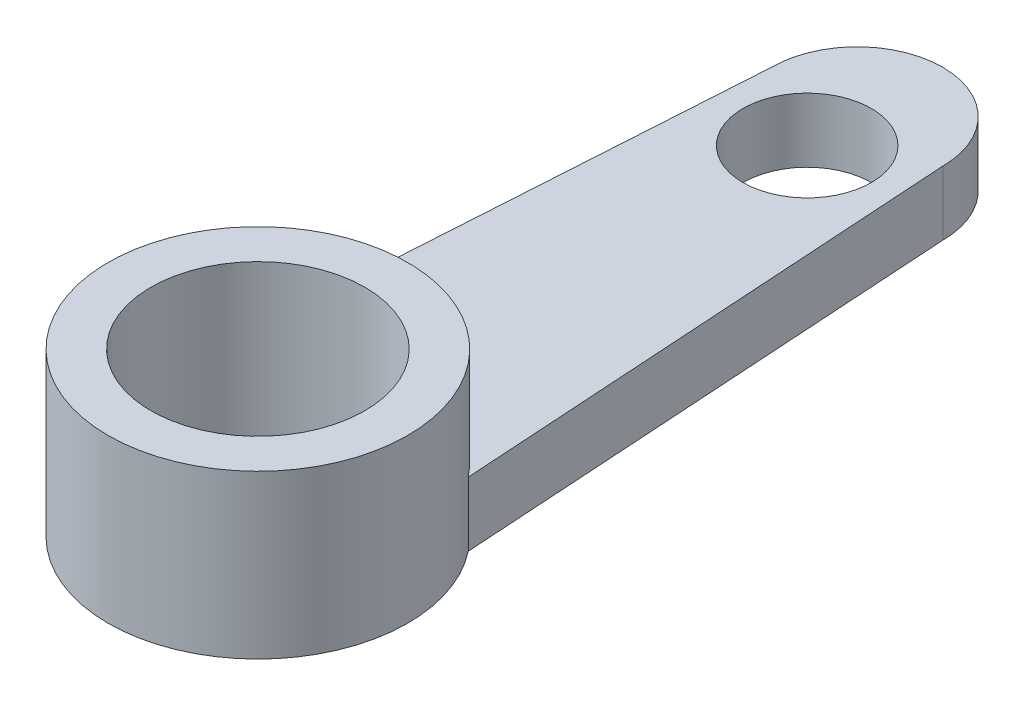
from build123d import *

# Parameters (mm, degrees)
SKETCH1_R           = 1.5
BOSS_EXTRUDE4_DEPTH = 1.5
SKETCH1_7_R         = 2.5
BOSS_EXTRUDE5_DEPTH = 3.8


with BuildPart() as part:
    # Sketch1 → Boss-Extrude4 (new body)
    with BuildSketch(Plane(origin=(0, 0, 0), x_dir=(1, 0, 0), z_dir=(0, 1, 0))):
        with BuildLine():
            Line((-29.654588032, -20.377951177), (-30.404588032, -32.212887668))
            ThreePointArc((-30.404588032, -32.212887668), (-27.654588032, -30.877951177), (-24.904588032, -32.212887668))
            Line((-24.904588032, -32.212887668), (-25.654588032, -20.377951177))
            ThreePointArc((-25.654588032, -20.377951177), (-27.654588032, -18.377951177), (-29.654588032, -20.377951177))
        make_face()
        with Locations((-27.654588032, -21.545225809)):
            Circle(SKETCH1_R, mode=Mode.SUBTRACT)
    extrude(amount=BOSS_EXTRUDE4_DEPTH)

    # Sketch1<7> → Boss-Extrude5 (add)
    with BuildSketch(Plane(origin=(0, 0, 0), x_dir=(1, 0, 0), z_dir=(0, 1, 0))):
        with BuildLine():
            ThreePointArc((-24.904588032, -32.212887668), (-27.654588032, -30.877951177), (-30.404588032, -32.212887668))
            ThreePointArc((-30.404588032, -32.212887668), (-28.800231955, -37.685140316), (-24.154588032, -34.377951177))
            ThreePointArc((-24.154588032, -34.377951177), (-24.347398893, -33.232307253), (-24.904588032, -32.212887668))
        make_face()
        with Locations((-27.654588032, -34.377951177)):
            Circle(SKETCH1_7_R, mode=Mode.SUBTRACT)
    extrude(amount=BOSS_EXTRUDE5_DEPTH)


solid = part.part
